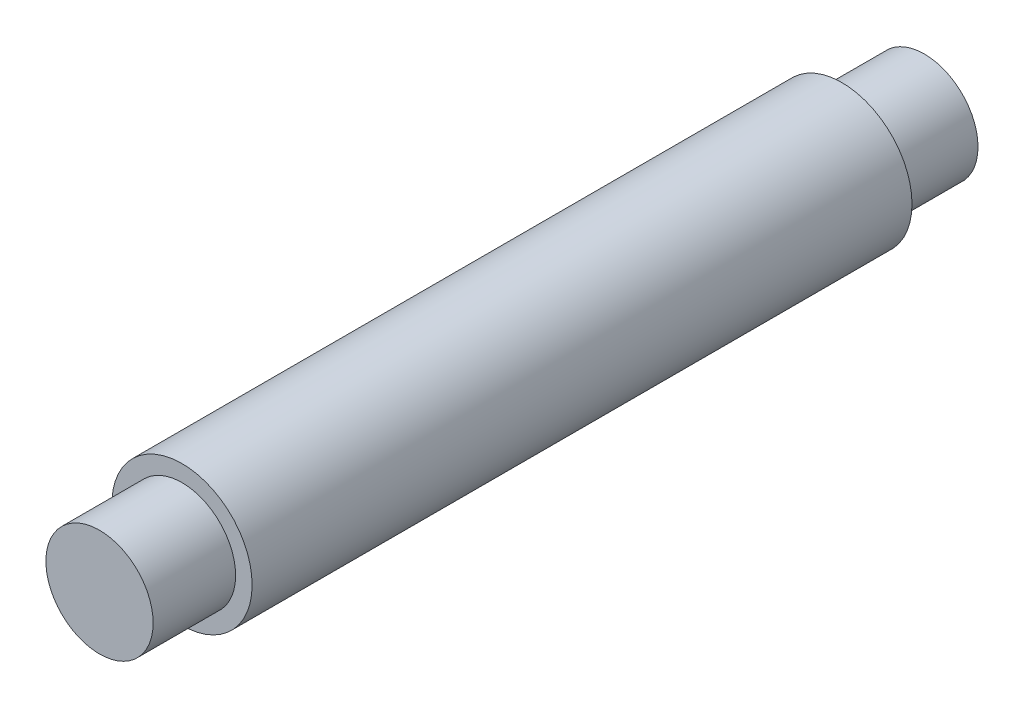
from build123d import *

# Parameters (mm, degrees)
SKETCH_1_R      = 8.5
EXTRUDE_1_DEPTH = 80
SKETCH_2_R      = 6.5
EXTRUDE_2_DEPTH = 10
EXTRUDE_START   = 10
SKETCH_3_R      = 6.5
EXTRUDE_3_DEPTH = 10


with BuildPart() as part:
    # 草图1 → 凸台-拉伸1 (new body)
    with BuildSketch(Plane.XY):
        Circle(SKETCH_1_R)
    extrude(amount=EXTRUDE_1_DEPTH)

    # 草图2 → 凸台-拉伸2 (add)
    with BuildSketch(Plane.XY.offset(80)):
        Circle(SKETCH_2_R)
    extrude(amount=EXTRUDE_2_DEPTH)

    # 草图3 → 凸台-拉伸3 (add)
    with BuildSketch(Plane(origin=(0, 0, 0), x_dir=(-1, 0, 0), z_dir=(0, 0, -1)).offset(EXTRUDE_START)):
        with Locations(Location((0, 0, 0), (0, 0, 180))):
            Circle(SKETCH_3_R)
    extrude(amount=-EXTRUDE_3_DEPTH)


solid = part.part
